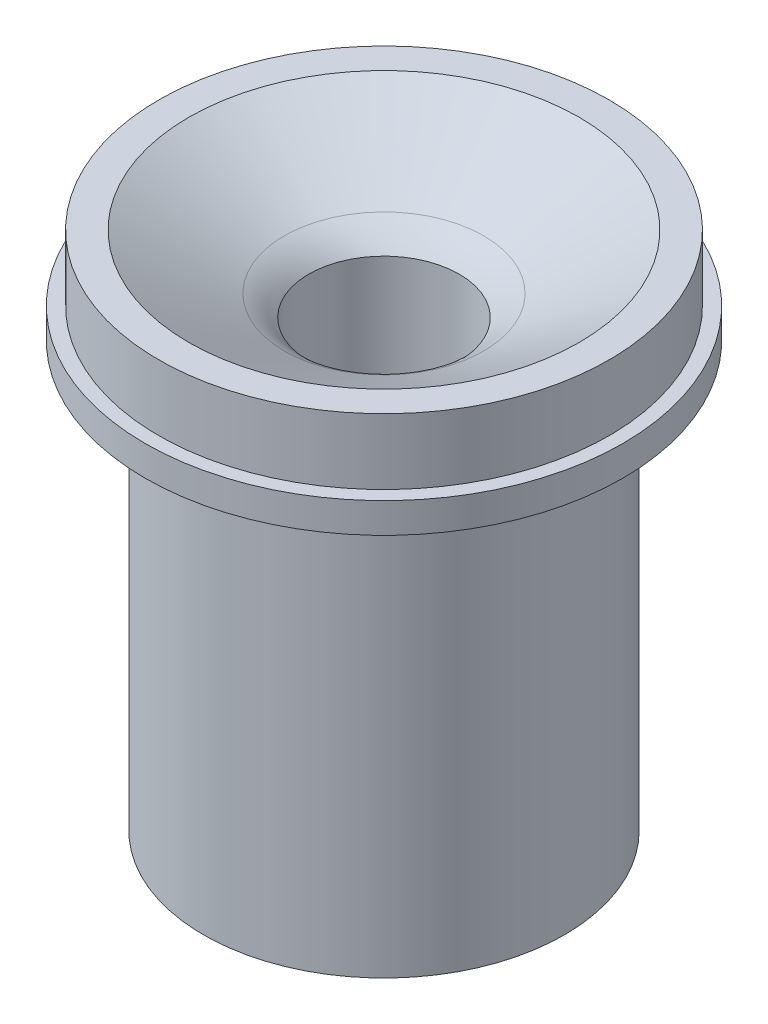
from build123d import *

# Parameters (mm, degrees)
CUT_EXTRUDE1_DEPTH      = 66.493994813
CUT_EXTRUDE1_DEPTH_BACK = 66.493994813
SKETCH2_R               = 7.9375


with BuildPart() as part:
    # Sketch1 → Revolve1 (revolve)
    with BuildSketch(Plane.XY, mode=Mode.PRIVATE) as revolve1_sk:
        Polygon((19.05, -11.8872), (19.05, -13.2842), (20.447, -11.8872), align=None)
        with BuildLine():
            ThreePointArc((5.771901147, -14.059921768), (7.048009176, -9.297421768), (10.534401147, -5.811029797))
            Line((10.534401147, -5.811029797), (20.5994, 0))
            Line((20.5994, 0), (23.7744, 0))
            Line((23.7744, 0), (23.7744, -6.9342))
            Line((23.7744, -6.9342), (25.2095, -6.9342))
            Line((25.2095, -6.9342), (25.2095, -10.1092))
            Line((25.2095, -10.1092), (22.2123, -10.1092))
            Line((22.2123, -10.1092), (22.2123, -11.8872))
            Line((22.2123, -11.8872), (19.05, -11.8872))
            Line((19.05, -11.8872), (19.05, -54.9402))
            Line((19.05, -54.9402), (15.875, -54.9402))
            Line((15.875, -54.9402), (5.771901147, -17.234921768))
            Line((5.771901147, -17.234921768), (5.771901147, -14.059921768))
        make_face()
    revolve(revolve1_sk.sketch.rotate(Axis((0, 0, 0), (0, 1, 0)), 90), axis=Axis((0, 0, 0), (0, 1, 0)))

    # Sketch2 → Cut-Extrude1 (cut, two sides: drawn at the far end of the back side and taken through both)
    with BuildSketch(Plane(origin=(0, 0, 0), x_dir=(1, 0, 0), z_dir=(0, 1, 0)).offset(-CUT_EXTRUDE1_DEPTH_BACK)):
        with Locations(Location((0, 0, 0), (0, 0, 90))):
            Circle(SKETCH2_R)
    extrude(amount=CUT_EXTRUDE1_DEPTH + CUT_EXTRUDE1_DEPTH_BACK, mode=Mode.SUBTRACT)


solid = part.part
